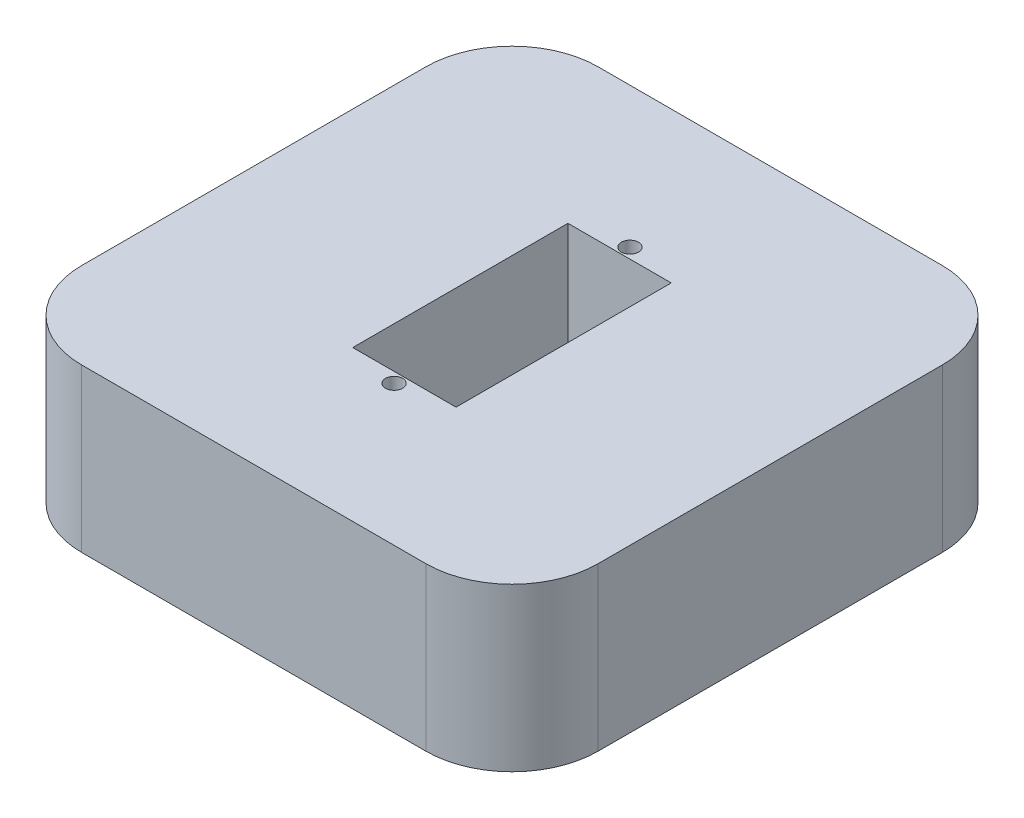
from build123d import *

# Parameters (mm, degrees)
SKETCH1_W           = 60
SKETCH1_H           = 60
BOSS_EXTRUDE1_DEPTH = 18.87
FILLET1_R           = 10
SKETCH3_W           = 12
SKETCH3_H           = 25
CUT_EXTRUDE1_DEPTH  = 47.433575137
SKETCH5_R           = 1
CUT_EXTRUDE2_DEPTH  = 47.433575137
SKETCH8_R           = 1
CUT_EXTRUDE3_DEPTH  = 47.433575137


with BuildPart() as part:
    # Sketch1 → Boss-Extrude1 (new body)
    with BuildSketch(Plane(origin=(0, 0, 0), x_dir=(1, 0, 0), z_dir=(0, 1, 0))):
        Rectangle(SKETCH1_W, SKETCH1_H)
    extrude(amount=BOSS_EXTRUDE1_DEPTH)

    # Fillet1
    fillet1_edges = [part.edges().sort_by_distance(p)[0] for p in [
        (-30, 9.435, 30),
        (30, 9.435, 30),
        (30, 9.435, -30),
        (-30, 9.435, -30),
    ]]
    fillet(fillet1_edges, radius=FILLET1_R)

    # Sketch3 → Cut-Extrude1 (cut, through all)
    with BuildSketch(Plane(origin=(0, 0, 0), x_dir=(-1, 0, 0), z_dir=(0, -1, 0))):
        Rectangle(SKETCH3_W, SKETCH3_H)
    extrude(amount=-CUT_EXTRUDE1_DEPTH, mode=Mode.SUBTRACT)

    # Sketch5 → Cut-Extrude2 (cut, through all)
    with BuildSketch(Plane(origin=(0, 18.87, 0), x_dir=(1, 0, 0), z_dir=(0, 1, 0))):
        with Locations(Location((0, 13.7, 0), (0, 0, 270))):
            Circle(SKETCH5_R)
    extrude(amount=-CUT_EXTRUDE2_DEPTH, mode=Mode.SUBTRACT)

    # Sketch8 → Cut-Extrude3 (cut, through all)
    with BuildSketch(Plane(origin=(0, 18.87, 0), x_dir=(1, 0, 0), z_dir=(0, 1, 0))):
        with Locations(Location((0, -13.7, 0), (0, 0, 270))):
            Circle(SKETCH8_R)
    extrude(amount=-CUT_EXTRUDE3_DEPTH, mode=Mode.SUBTRACT)


solid = part.part
